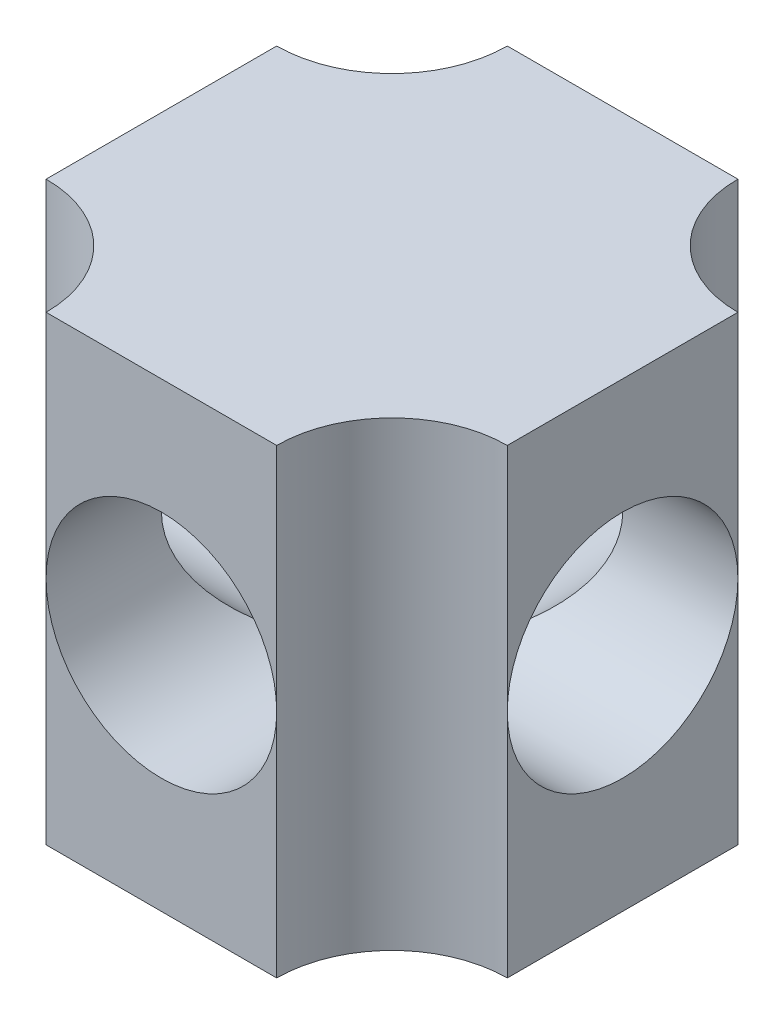
from build123d import *

# Parameters (mm, degrees)
SKETCH1_W            = 100
SKETCH1_H            = 100
BOSS_EXTRUDE1_DEPTH  = 100
SKETCH3_R            = 25
CUT_EXTRUDE3_DEPTH   = 151
SKETCH5_R            = 25
CUT_EXTRUDE4_DEPTH   = 151
SKETCH9_R            = 25
CUT_EXTRUDE5_DEPTH   = 100
LPATTERN1_COUNT      = 2
LPATTERN1_PITCH      = 100
LPATTERN1_COUNT_DIR2 = 2
LPATTERN1_PITCH_DIR2 = 100


with BuildPart() as part:
    # Sketch1 → Boss-Extrude1 (new body)
    with BuildSketch(Plane(origin=(0, 0, 0), x_dir=(1, 0, 0), z_dir=(0, 1, 0))):
        Rectangle(SKETCH1_W, SKETCH1_H)
    extrude(amount=BOSS_EXTRUDE1_DEPTH)

    # Sketch3 → Cut-Extrude3 (cut, through all)
    with BuildSketch(Plane.XY.offset(50)):
        with Locations((0, 50)):
            Circle(SKETCH3_R)
    extrude(amount=-CUT_EXTRUDE3_DEPTH, mode=Mode.SUBTRACT)

    # Sketch5 → Cut-Extrude4 (cut, through all)
    with BuildSketch(Plane.ZY.offset(50)):
        with Locations((0, 50)):
            Circle(SKETCH5_R)
    extrude(amount=-CUT_EXTRUDE4_DEPTH, mode=Mode.SUBTRACT)

    # Sketch9 → Cut-Extrude5 (cut)
    with BuildSketch(Plane.ZX.offset(100)):
        with Locations((-50, -50)):
            Circle(SKETCH9_R)
    cut_extrude5 = extrude(amount=-CUT_EXTRUDE5_DEPTH, mode=Mode.SUBTRACT)

    # LPattern1: Cut-Extrude5 2 × 2
    with Locations(*[(i * LPATTERN1_PITCH, 0, j * LPATTERN1_PITCH_DIR2) for i in range(LPATTERN1_COUNT) for j in range(LPATTERN1_COUNT_DIR2) if (i, j) != (0, 0)]):
        add(cut_extrude5, mode=Mode.SUBTRACT)


solid = part.part
